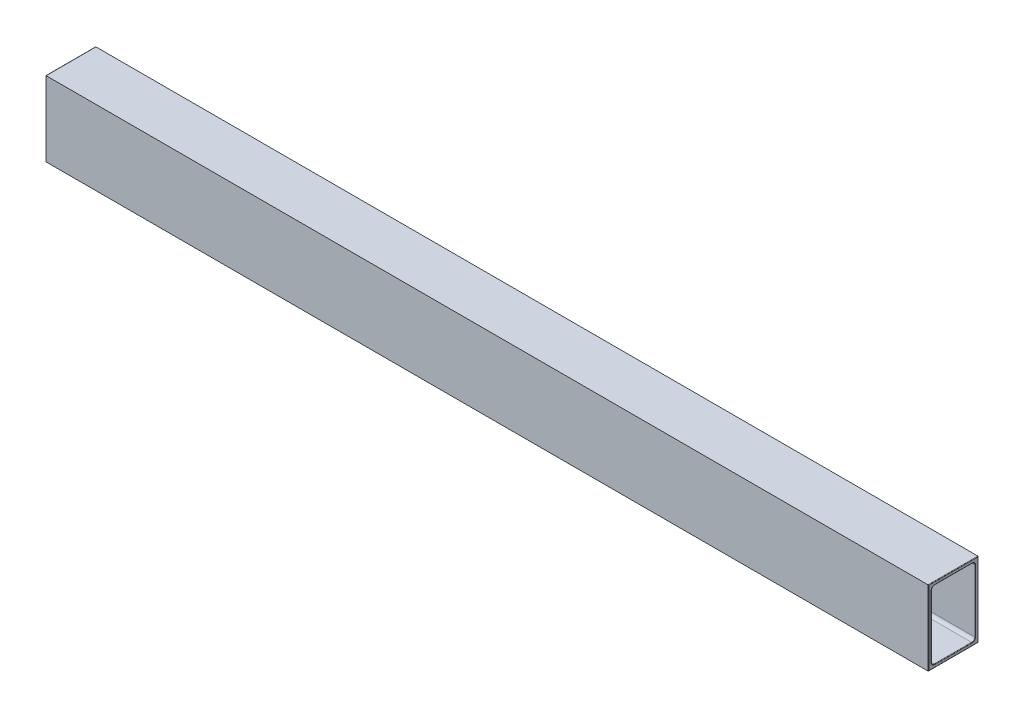
from build123d import *

# Parameters (mm, degrees)
SKETCH1_W           = 101.6
SKETCH1_H           = 152.4
BOSS_EXTRUDE1_DEPTH = 1800
FILLET1_R           = 1


with BuildPart() as part:
    # Sketch1 → Boss-Extrude1 (new body)
    with BuildSketch(Plane(origin=(0, 0, 0), x_dir=(0, 0, -1), z_dir=(1, 0, 0))):
        with Locations((-50.8, 76.2)):
            Rectangle(SKETCH1_W, SKETCH1_H)
        with BuildLine():
            Line((-95.25, 12.7), (-95.25, 139.7))
            ThreePointArc((-95.25, 139.7), (-93.390128061, 144.190128061), (-88.9, 146.05))
            Line((-88.9, 146.05), (-12.7, 146.05))
            ThreePointArc((-12.7, 146.05), (-8.209871939, 144.190128061), (-6.35, 139.7))
            Line((-6.35, 139.7), (-6.35, 12.7))
            ThreePointArc((-6.35, 12.7), (-8.209871939, 8.209871939), (-12.7, 6.35))
            Line((-12.7, 6.35), (-88.9, 6.35))
            ThreePointArc((-88.9, 6.35), (-93.390128061, 8.209871939), (-95.25, 12.7))
        make_face(mode=Mode.SUBTRACT)
    extrude(amount=BOSS_EXTRUDE1_DEPTH)

    # Fillet1
    fillet1_edges = [part.edges().sort_by_distance(p)[0] for p in [
        (1800, 76.2, 101.6),
        (1800, 0, 50.8),
        (0, 8.209871939, 93.390128061),
        (0, 6.35, 50.8),
        (0, 8.209871939, 8.209871939),
        (0, 76.2, 6.35),
        (0, 144.190128061, 8.209871939),
        (0, 146.05, 50.8),
        (0, 144.190128061, 93.390128061),
        (0, 76.2, 95.25),
        (1800, 8.209871939, 93.390128061),
        (1800, 6.35, 50.8),
        (1800, 8.209871939, 8.209871939),
        (1800, 76.2, 6.35),
        (1800, 144.190128061, 8.209871939),
        (1800, 146.05, 50.8),
        (1800, 144.190128061, 93.390128061),
        (1800, 76.2, 95.25),
        (1800, 76.2, 0),
        (0, 0, 50.8),
        (0, 76.2, 101.6),
        (0, 152.4, 50.8),
        (0, 76.2, 0),
        (1800, 152.4, 50.8),
    ]]
    fillet(fillet1_edges, radius=FILLET1_R)


solid = part.part
